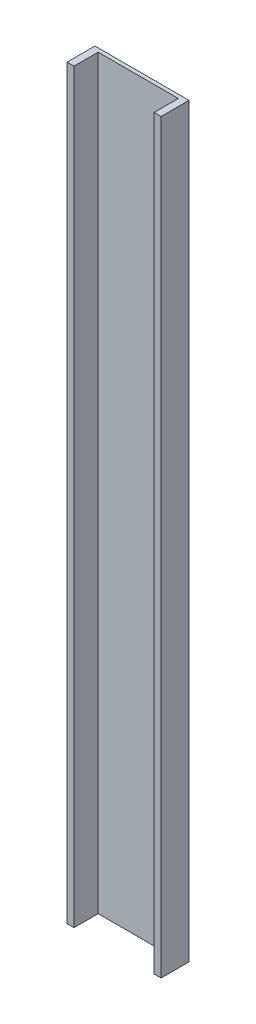
from build123d import *

# Parameters (mm, degrees)
BOSS_EXTRUDE1_DEPTH = 214


with BuildPart() as part:
    # Sketch1 → Boss-Extrude1 (new body)
    with BuildSketch(Plane(origin=(0, 0, 0), x_dir=(1, 0, 0), z_dir=(0, 1, 0))):
        Polygon((-6.5, -4), (-6.5, 2.938756375), (16.5, 2.938756375), (16.5, -4), (18.5, -4), (18.5, 4), (-8.5, 4), (-8.5, -4), align=None)
    extrude(amount=BOSS_EXTRUDE1_DEPTH)


solid = part.part
